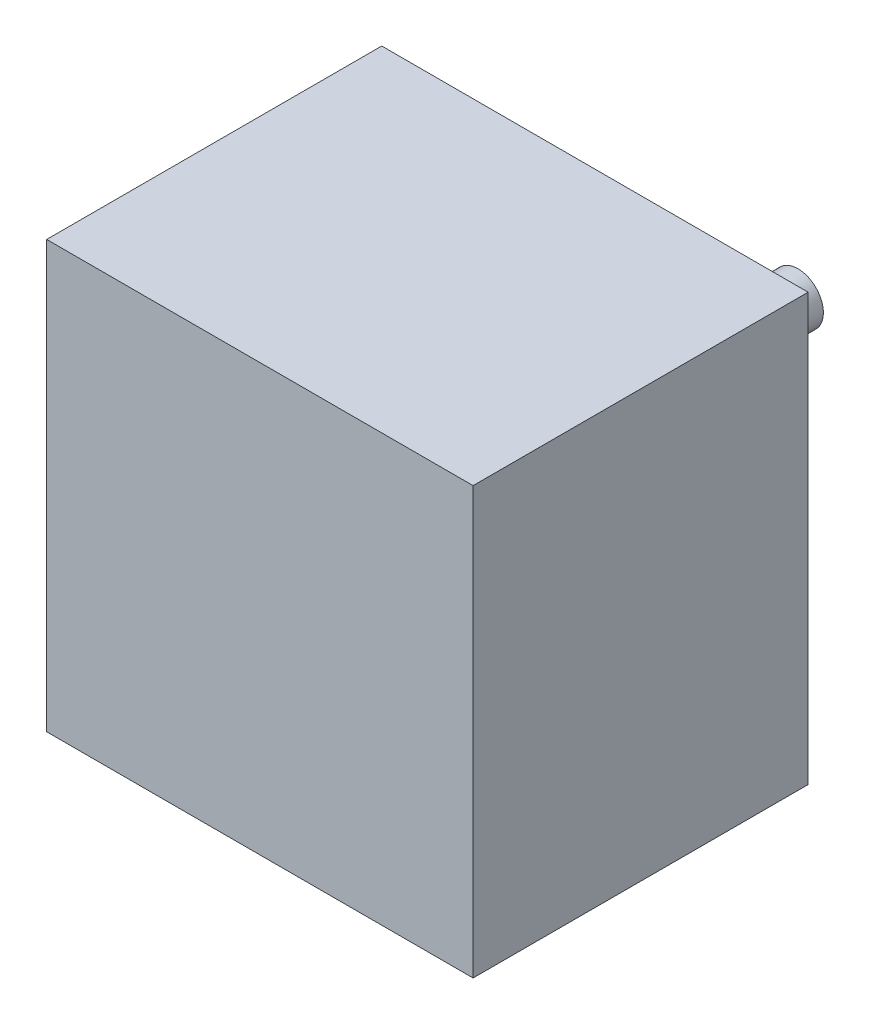
from build123d import *

# Parameters (mm, degrees)
SKETCH_1_W          = 42
SKETCH_1_H          = 42
EXTRUDE_1_DEPTH     = 33
SKETCH_3_R          = 11
EXTRUDE_2_DEPTH     = 2
SKETCH_4_R          = 2.5
EXTRUDE_3_DEPTH     = 18
SKETCH_5_R          = 1.5
CUT_EXTRUDE_1_DEPTH = 8


with BuildPart() as part:
    # 草图1 → 凸台-拉伸1 (new body)
    with BuildSketch(Plane.XY):
        with Locations((-21, 21)):
            Rectangle(SKETCH_1_W, SKETCH_1_H)
    extrude(amount=EXTRUDE_1_DEPTH)

    # 草图3 → 凸台-拉伸2 (add)
    with BuildSketch(Plane(origin=(0, 0, 0), x_dir=(-1, 0, 0), z_dir=(0, 0, -1))):
        with Locations((21, 21)):
            Circle(SKETCH_3_R)
    extrude(amount=EXTRUDE_2_DEPTH)

    # 草图4 → 凸台-拉伸3 (add)
    with BuildSketch(Plane(origin=(0, 0, -2), x_dir=(-1, 0, 0), z_dir=(0, 0, -1))):
        with Locations((21, 21)):
            Circle(SKETCH_4_R)
    extrude(amount=EXTRUDE_3_DEPTH)

    # 草图5 → 切除-拉伸1 (cut)
    with BuildSketch(Plane(origin=(0, 0, 0), x_dir=(-1, 0, 0), z_dir=(0, 0, -1))):
        with Locations((5.5, 5.5)):
            Circle(SKETCH_5_R)
        with Locations((36.5, 5.5)):
            Circle(SKETCH_5_R)
        with Locations((36.5, 36.5)):
            Circle(SKETCH_5_R)
        with Locations((5.5, 36.5)):
            Circle(SKETCH_5_R)
    extrude(amount=-CUT_EXTRUDE_1_DEPTH, mode=Mode.SUBTRACT)


solid = part.part
